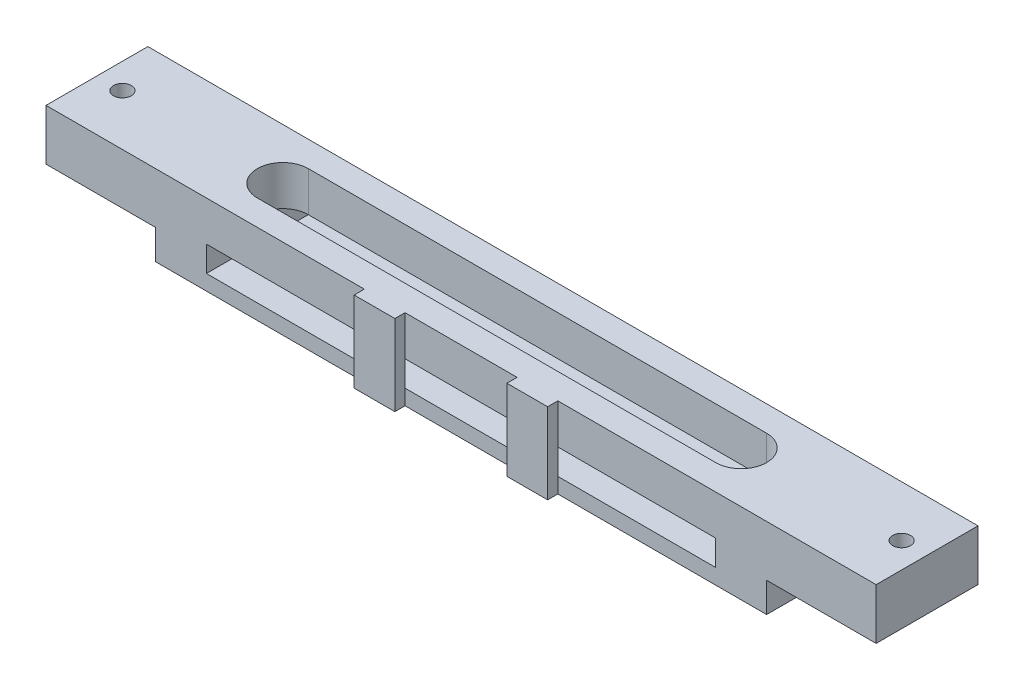
from build123d import *

# Parameters (mm, degrees)
SKETCH1_W               = 163
SKETCH1_H               = 10
BOSS_EXTRUDE1_DEPTH     = 20
SKETCH4_W               = 120
SKETCH4_H               = 20
BOSS_EXTRUDE2_DEPTH     = 5.84
CUT_EXTRUDE1_REACH      = 86.512
SKETCH5_W               = 100
SKETCH5_H               = 5
CUT_EXTRUDE2_DEPTH      = 10
CUT_EXTRUDE3_DEPTH      = 86.399974239
CUT_EXTRUDE3_DEPTH_BACK = 86.399974239
SKETCH2_R               = 1.75
SKETCH7_W               = 8
SKETCH7_H               = 15.84
BOSS_EXTRUDE3_DEPTH     = 2


with BuildPart() as part:
    # Sketch1 → Boss-Extrude1 (new body)
    with BuildSketch(Plane.XY):
        with Locations((0, 5)):
            Rectangle(SKETCH1_W, SKETCH1_H)
    extrude(amount=BOSS_EXTRUDE1_DEPTH)

    # Sketch4 → Boss-Extrude2 (add)
    with BuildSketch(Plane.XZ):
        with Locations((0, 10)):
            Rectangle(SKETCH4_W, SKETCH4_H)
        with BuildLine():
            Line((-45, 12.35), (45, 12.35))
            ThreePointArc((45, 12.35), (47.35, 10), (45, 7.65))
            Line((45, 7.65), (-45, 7.65))
            ThreePointArc((-45, 7.65), (-47.35, 10), (-45, 12.35))
        make_face(mode=Mode.SUBTRACT)
    extrude(amount=BOSS_EXTRUDE2_DEPTH)

    # Cut-Extrude1: up to this face of the body (flat: up to its plane)
    cut_extrude1_end = Plane(part.part.faces().sort_by_distance((0, 2.618699159, 0))[0])
    # Sketch5 → Cut-Extrude1 (cut, up to the picked face)
    with BuildSketch(Plane.XY.offset(20), mode=Mode.PRIVATE) as cut_extrude1_sk1:
        with Locations((0, -0.34)):
            Rectangle(SKETCH5_W, SKETCH5_H)
    cut_extrude1_tool1 = split(extrude(cut_extrude1_sk1.sketch, amount=-CUT_EXTRUDE1_REACH, mode=Mode.PRIVATE), bisect_by=cut_extrude1_end, keep=Keep.BOTH, mode=Mode.PRIVATE)
    add(cut_extrude1_tool1.solids().sort_by(Axis((0, -0.34, 20), (0, 0, -1)))[0], mode=Mode.SUBTRACT)

    # Sketch6 → Cut-Extrude2 (cut)
    with BuildSketch(Plane.XZ.offset(-2.16)):
        with BuildLine():
            Line((-45, 5), (45, 5))
            ThreePointArc((45, 5), (50, 10), (45, 15))
            Line((45, 15), (-45, 15))
            ThreePointArc((-45, 15), (-50, 10), (-45, 5))
        make_face()
    extrude(amount=-CUT_EXTRUDE2_DEPTH, mode=Mode.SUBTRACT)

    # Sketch2 → Cut-Extrude3 (cut, two sides: drawn at the far end of the back side and taken through both)
    with BuildSketch(Plane(origin=(0, 10, 0), x_dir=(1, 0, 0), z_dir=(0, 1, 0)).offset(-CUT_EXTRUDE3_DEPTH_BACK)):
        with Locations(Location((76.5, -10, 0), (0, 0, 180))):
            Circle(SKETCH2_R)
        with Locations(Location((-76.5, -10, 0), (0, 0, 180))):
            Circle(SKETCH2_R)
    extrude(amount=CUT_EXTRUDE3_DEPTH + CUT_EXTRUDE3_DEPTH_BACK, mode=Mode.SUBTRACT)

    # Sketch7 → Boss-Extrude3 (add)
    with BuildSketch(Plane.XY.offset(20)):
        with Locations((-15, 2.08)):
            Rectangle(SKETCH7_W, SKETCH7_H)
        with Locations((15, 2.08)):
            Rectangle(SKETCH7_W, SKETCH7_H)
    extrude(amount=BOSS_EXTRUDE3_DEPTH)


solid = part.part
